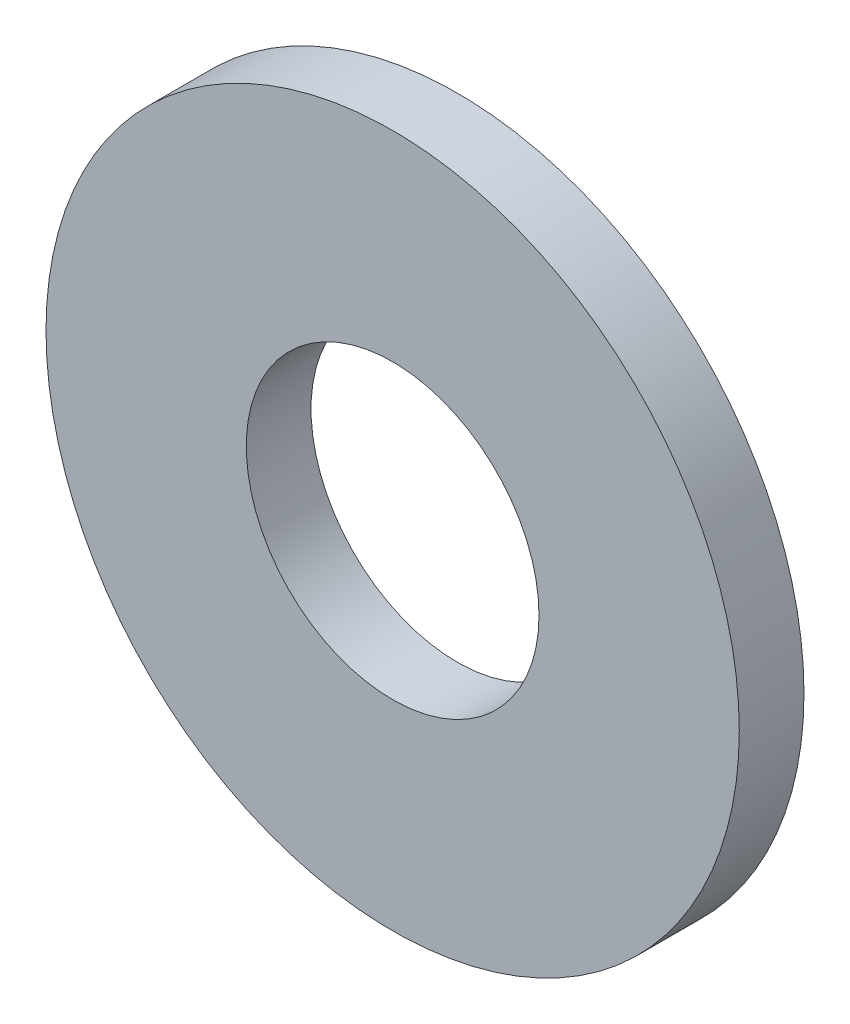
from build123d import *

# Parameters (mm, degrees)
SKETCH1_R           = 5.715
SKETCH1_R_2         = 2.413
BOSS_EXTRUDE1_DEPTH = 1.0668


with BuildPart() as part:
    # Sketch1 → Boss-Extrude1 (new body)
    with BuildSketch(Plane.XY):
        Circle(SKETCH1_R)
        Circle(SKETCH1_R_2, mode=Mode.SUBTRACT)
    extrude(amount=BOSS_EXTRUDE1_DEPTH)


solid = part.part
